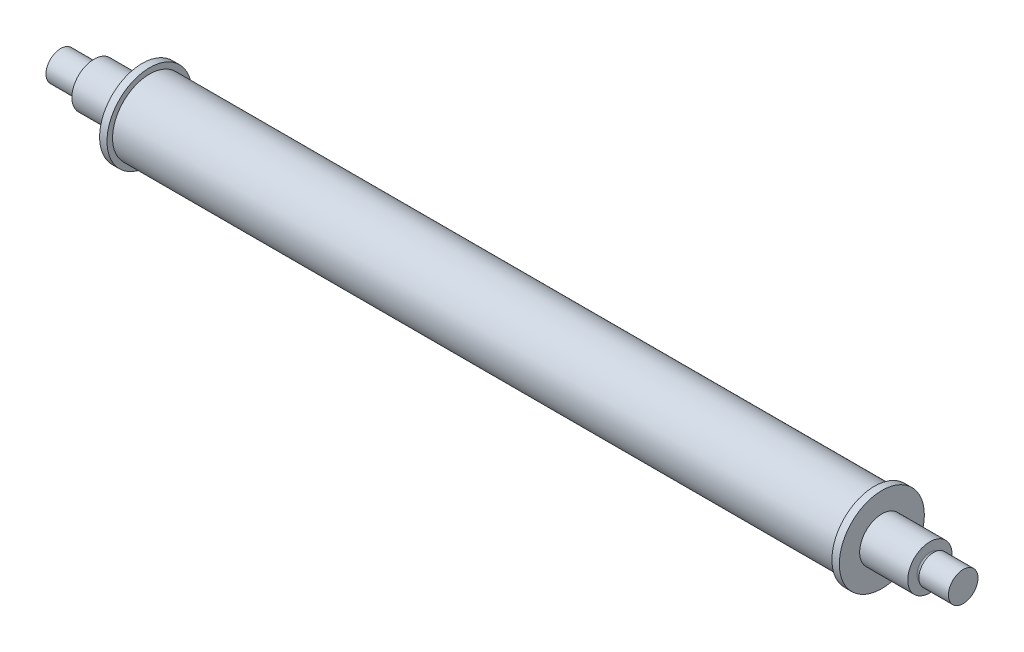
from build123d import *


with BuildPart() as part:
    # Sketch1 → Revolve1 (revolve)
    with BuildSketch(Plane.XY, mode=Mode.PRIVATE) as revolve1_sk:
        with BuildLine():
            Line((-75.076923077, 2.461538462), (-75.076923077, 0))
            Line((-75.076923077, 0), (75.076923077, 0))
            Line((75.076923077, 0), (75.076923077, 2.461538462))
            Line((75.076923077, 2.461538462), (70.153846154, 2.461538462))
            Line((70.153846154, 2.461538462), (70.153846154, 2.153846154))
            ThreePointArc((70.153846154, 2.153846154), (69.846153846, 1.846153846), (69.538461538, 2.153846154))
            Line((69.538461538, 2.153846154), (69.538461538, 3.692307692))
            Line((69.538461538, 3.692307692), (61.538461538, 3.692307692))
            Line((61.538461538, 3.692307692), (61.538461538, 7.076923077))
            Line((61.538461538, 7.076923077), (60.307692308, 7.076923077))
            Line((60.307692308, 7.076923077), (60.307692308, 6.153846154))
            Line((60.307692308, 6.153846154), (-60.307692308, 6.153846154))
            Line((-60.307692308, 6.153846154), (-60.307692308, 7.076923077))
            Line((-60.307692308, 7.076923077), (-61.538461538, 7.076923077))
            Line((-61.538461538, 7.076923077), (-61.538461538, 3.692307692))
            Line((-61.538461538, 3.692307692), (-69.538461538, 3.692307692))
            Line((-69.538461538, 3.692307692), (-69.538461538, 2.153846154))
            ThreePointArc((-69.538461538, 2.153846154), (-69.846153846, 1.846153846), (-70.153846154, 2.153846154))
            Line((-70.153846154, 2.153846154), (-70.153846154, 2.461538462))
            Line((-70.153846154, 2.461538462), (-75.076923077, 2.461538462))
        make_face()
    revolve(revolve1_sk.sketch.rotate(Axis((-75.076923077, 0, 0), (1, 0, 0)), 270), axis=Axis((-75.076923077, 0, 0), (1, 0, 0)))


solid = part.part
